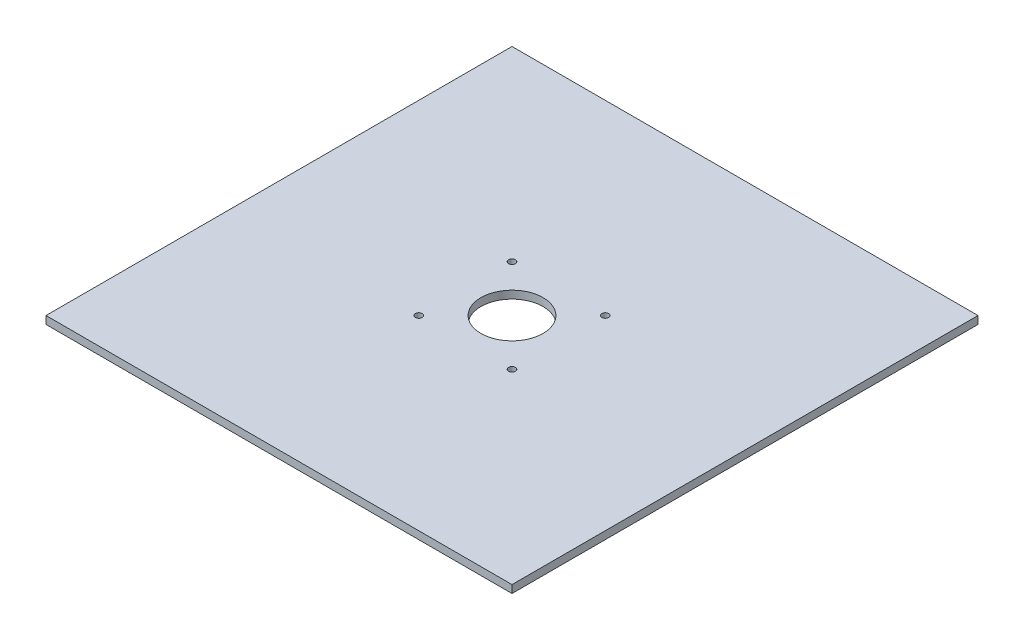
from build123d import *

# Parameters (mm, degrees)
SKETCH1_W           = 300
SKETCH1_H           = 300
SKETCH1_R           = 20
SKETCH1_R_2         = 2.2
BOSS_EXTRUDE1_DEPTH = 5


with BuildPart() as part:
    # Sketch1 → Boss-Extrude1 (new body)
    with BuildSketch(Plane(origin=(0, 0, 0), x_dir=(1, 0, 0), z_dir=(0, 1, 0))):
        Rectangle(SKETCH1_W, SKETCH1_H)
        with Locations(Location((0, 0, 0), (0, 0, 270))):
            Circle(SKETCH1_R, mode=Mode.SUBTRACT)
        with Locations(Location((-30, 30, 0), (0, 0, 270))):
            Circle(SKETCH1_R_2, mode=Mode.SUBTRACT)
        with Locations(Location((30, 30, 0), (0, 0, 270))):
            Circle(SKETCH1_R_2, mode=Mode.SUBTRACT)
        with Locations(Location((30, -30, 0), (0, 0, 270))):
            Circle(SKETCH1_R_2, mode=Mode.SUBTRACT)
        with Locations(Location((-30, -30, 0), (0, 0, 270))):
            Circle(SKETCH1_R_2, mode=Mode.SUBTRACT)
    extrude(amount=BOSS_EXTRUDE1_DEPTH)


solid = part.part
